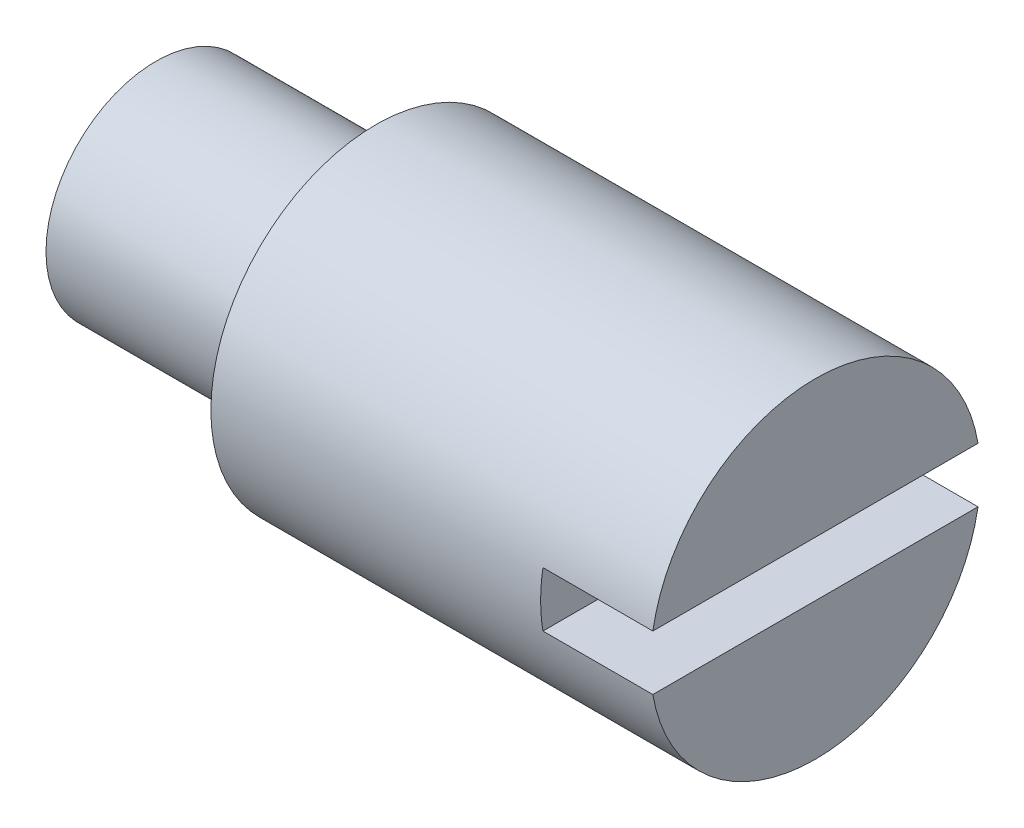
from build123d import *

# Parameters (mm, degrees)
CUT_EXTRUDE1_DEPTH      = 13.727922061
CUT_EXTRUDE1_DEPTH_BACK = 13.727922061
SKETCH2_W               = 2
SKETCH2_H               = 1


with BuildPart() as part:
    # Sketch1 → Revolve1 (revolve)
    with BuildSketch(Plane.XY, mode=Mode.PRIVATE) as revolve1_sk:
        Polygon((0, 0), (0, 2), (4, 2), (4, 3), (12, 3), (12, 0), align=None)
    revolve(revolve1_sk.sketch.rotate(Axis((-2.880915106, 0, 0), (1, 0, 0)), 90), axis=Axis((-2.880915106, 0, 0), (1, 0, 0)))

    # Sketch2 → Cut-Extrude1 (cut, two sides: drawn at the far end of the back side and taken through both)
    with BuildSketch(Plane.XY.offset(-CUT_EXTRUDE1_DEPTH_BACK)):
        with Locations((11, 0)):
            Rectangle(SKETCH2_W, SKETCH2_H)
    extrude(amount=CUT_EXTRUDE1_DEPTH + CUT_EXTRUDE1_DEPTH_BACK, mode=Mode.SUBTRACT)


solid = part.part
